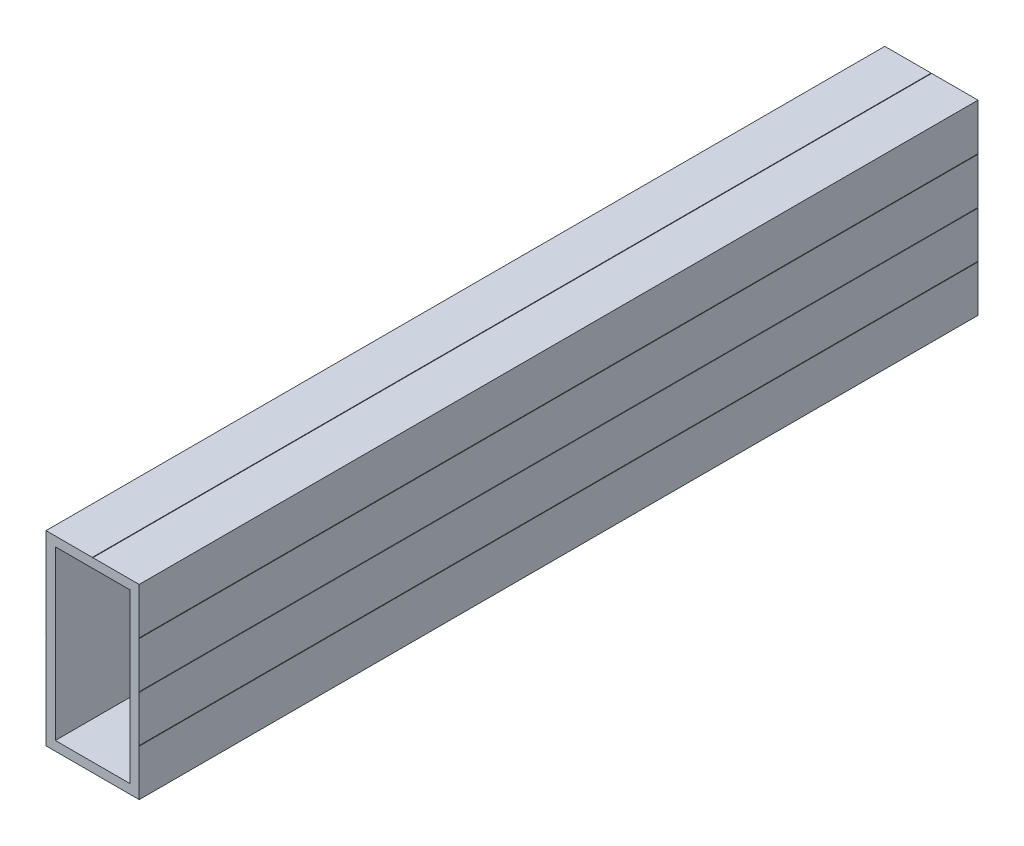
from build123d import *

# Parameters (mm, degrees)
SKETCH1_W           = 1498.6
SKETCH1_H           = 50.8
BOSS_EXTRUDE1_DEPTH = 25.4
CUT_EXTRUDE1_DEPTH  = 1498.6
CUT_EXTRUDE2_DEPTH  = 1499.869043646
CUT_EXTRUDE3_DEPTH  = 1498.6
CUT_EXTRUDE4_DEPTH  = 1498.6
CUT_EXTRUDE5_DEPTH  = 1499.869043646
CUT_EXTRUDE6_DEPTH  = 1499.869043646
CUT_EXTRUDE7_DEPTH  = 1498.6
CUT_EXTRUDE8_DEPTH  = 1498.6
SKETCH10_W          = 20.32
SKETCH10_H          = 45.72
CUT_EXTRUDE9_DEPTH  = 1499.869043646
DRAFT1_ANGLE        = 45
DRAFT2_ANGLE        = 45.000000005
DRAFT3_ANGLE        = 45
DRAFT4_ANGLE        = 45
DRAFT5_ANGLE        = 45
DRAFT6_ANGLE        = 44.999999995
SKETCH11_W          = 61.962293059
SKETCH11_H          = 88.678950317
CUT_EXTRUDE10_DEPTH = 1270


with BuildPart() as part:
    # Sketch1 → Boss-Extrude1 (new body)
    with BuildSketch(Plane(origin=(12.7, 0, 0), x_dir=(0, 0, -1), z_dir=(1, 0, 0))):
        Rectangle(SKETCH1_W, SKETCH1_H)
    extrude(amount=-BOSS_EXTRUDE1_DEPTH)

    # Sketch2 → Cut-Extrude1 (cut)
    with BuildSketch(Plane.XY.offset(749.3)):
        Polygon((0.0762, 25.4), (-0.0762, 25.4), (0.0762, 25.2476), align=None)
    extrude(amount=-CUT_EXTRUDE1_DEPTH, mode=Mode.SUBTRACT)

    # Sketch3 → Cut-Extrude2 (cut, through all)
    with BuildSketch(Plane.XY.offset(749.3)):
        Polygon((12.7, 12.6238), (12.7, 12.7762), (12.5476, 12.7762), align=None)
    extrude(amount=-CUT_EXTRUDE2_DEPTH, mode=Mode.SUBTRACT)

    # Sketch4 → Cut-Extrude3 (cut)
    with BuildSketch(Plane.XY.offset(749.3)):
        Polygon((12.7, -0.0762), (12.7, 0.0762), (12.5476, -0.0762), align=None)
    extrude(amount=-CUT_EXTRUDE3_DEPTH, mode=Mode.SUBTRACT)

    # Sketch5 → Cut-Extrude4 (cut)
    with BuildSketch(Plane.XY.offset(749.3)):
        Polygon((12.7, -12.7762), (12.7, -12.6238), (12.5476, -12.6238), align=None)
    extrude(amount=-CUT_EXTRUDE4_DEPTH, mode=Mode.SUBTRACT)

    # Sketch6 → Cut-Extrude5 (cut, through all)
    with BuildSketch(Plane.XY.offset(749.3)):
        Polygon((0.0762, -25.4), (-0.0762, -25.2476), (-0.0762, -25.4), align=None)
    extrude(amount=-CUT_EXTRUDE5_DEPTH, mode=Mode.SUBTRACT)

    # Sketch7 → Cut-Extrude6 (cut, through all)
    with BuildSketch(Plane.XY.offset(749.3)):
        Polygon((-12.7, -12.6238), (-12.7, -12.7762), (-12.5476, -12.7762), align=None)
    extrude(amount=-CUT_EXTRUDE6_DEPTH, mode=Mode.SUBTRACT)

    # Sketch8 → Cut-Extrude7 (cut)
    with BuildSketch(Plane.XY.offset(749.3)):
        Polygon((-12.7, 0.0762), (-12.7, -0.0762), (-12.5476, 0.0762), align=None)
    extrude(amount=-CUT_EXTRUDE7_DEPTH, mode=Mode.SUBTRACT)

    # Sketch9 → Cut-Extrude8 (cut)
    with BuildSketch(Plane.XY.offset(749.3)):
        Polygon((-12.7, 12.7762), (-12.7, 12.6238), (-12.5476, 12.6238), align=None)
    extrude(amount=-CUT_EXTRUDE8_DEPTH, mode=Mode.SUBTRACT)

    # Sketch10 → Cut-Extrude9 (cut, through all)
    with BuildSketch(Plane.XY.offset(749.3)):
        Rectangle(SKETCH10_W, SKETCH10_H)
    extrude(amount=-CUT_EXTRUDE9_DEPTH, mode=Mode.SUBTRACT)

    # Draft1
    draft1_faces = [part.faces().sort_by_distance(p)[0] for p in [
        (0.0762, 25.3238, 0),
    ]]
    draft(draft1_faces, Plane(origin=(-12.7, 25.4, -749.3), x_dir=(0, 0, 1), z_dir=(0, 1, 0)), DRAFT1_ANGLE)

    # Draft2
    draft2_faces = [part.faces().sort_by_distance(p)[0] for p in [
        (12.6238, 12.7762, 0),
    ]]
    draft(draft2_faces, Plane(origin=(12.7, 0, 0), x_dir=(0, 0, 1), z_dir=(1, 0, 0)), DRAFT2_ANGLE)

    # Draft3
    draft3_faces = [part.faces().sort_by_distance(p)[0] for p in [
        (-0.0762, -25.3238, 0),
    ]]
    draft(draft3_faces, Plane(origin=(-12.7, -25.4, 749.3), x_dir=(0, 0, -1), z_dir=(0, -1, 0)), DRAFT3_ANGLE)

    # Draft4
    draft4_faces = [part.faces().sort_by_distance(p)[0] for p in [
        (-12.6238, -12.7762, 0),
    ]]
    draft(draft4_faces, Plane(origin=(-12.7, 0, 0), x_dir=(0, 0, -1), z_dir=(-1, 0, 0)), DRAFT4_ANGLE)

    # Draft5
    draft5_faces = [part.faces().sort_by_distance(p)[0] for p in [
        (12.6238, -12.6238, 0),
        (12.6238, 0, 0),
    ]]
    draft(draft5_faces, Plane(origin=(12.7, 0, 0), x_dir=(0, 0, 1), z_dir=(1, 0, 0)), DRAFT5_ANGLE)

    # Draft6
    draft6_faces = [part.faces().sort_by_distance(p)[0] for p in [
        (-12.6238, 0, 0),
        (-12.6238, 12.6238, 0),
    ]]
    draft(draft6_faces, Plane(origin=(-12.7, 0, 0), x_dir=(0, 0, -1), z_dir=(-1, 0, 0)), DRAFT6_ANGLE)

    # Sketch11 → Cut-Extrude10 (cut)
    with BuildSketch(Plane(origin=(0, 0, -749.3), x_dir=(-1, 0, 0), z_dir=(0, 0, -1))):
        with Locations((-2.92473676, 0.325700182)):
            Rectangle(SKETCH11_W, SKETCH11_H)
    extrude(amount=-CUT_EXTRUDE10_DEPTH, mode=Mode.SUBTRACT)


solid = part.part
